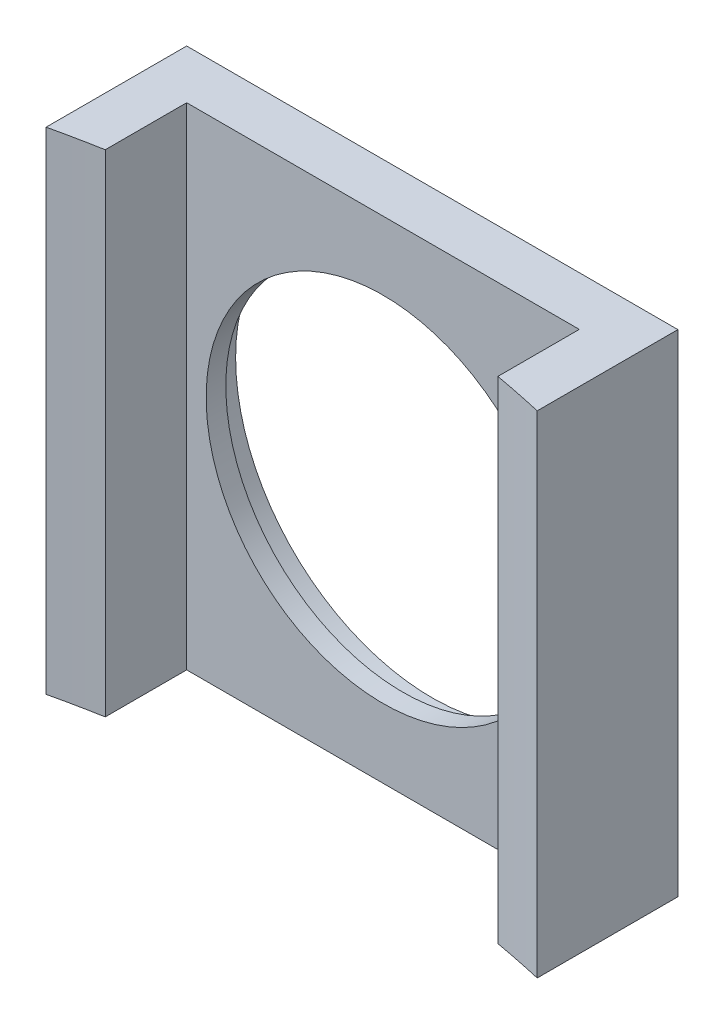
from build123d import *

# Parameters (mm, degrees)
SKETCH2_W               = 50
SKETCH2_H               = 50
BOSS_EXTRUDE1_DEPTH     = 5
SKETCH3_W               = 5
SKETCH3_H               = 50
SKETCH3_W_2             = 5.036023039
BOSS_EXTRUDE2_DEPTH     = 11
CUT_EXTRUDE3_DEPTH      = 51.174718111
CUT_EXTRUDE3_DEPTH_BACK = 51.174718111
SKETCH5_R               = 18
SKETCH6_R               = 20
CUT_EXTRUDE4_DEPTH      = 3
CUT_EXTRUDE5_DEPTH      = 51.174718111
CUT_EXTRUDE5_DEPTH_BACK = 51.174718111
SKETCH7_R               = 112.5


with BuildPart() as part:
    # Sketch2 → Boss-Extrude1 (new body)
    with BuildSketch(Plane.XY):
        with Locations((-12.301587302, 4.497354497)):
            Rectangle(SKETCH2_W, SKETCH2_H)
    extrude(amount=BOSS_EXTRUDE1_DEPTH)

    # Sketch3 → Boss-Extrude2 (add)
    with BuildSketch(Plane.XY.offset(5)):
        with Locations((-34.801587302, 4.497354497)):
            Rectangle(SKETCH3_W, SKETCH3_H)
        with Locations((10.180401179, 4.497354497)):
            Rectangle(SKETCH3_W_2, SKETCH3_H)
    extrude(amount=BOSS_EXTRUDE2_DEPTH)

    # Sketch5 → Cut-Extrude3 (cut, two sides: drawn at the far end of the back side and taken through both)
    with BuildSketch(Plane.XY.offset(-CUT_EXTRUDE3_DEPTH_BACK)):
        with Locations((-12.319598821, 4.529496056)):
            Circle(SKETCH5_R)
    extrude(amount=CUT_EXTRUDE3_DEPTH + CUT_EXTRUDE3_DEPTH_BACK, mode=Mode.SUBTRACT)

    # Sketch6 → Cut-Extrude4 (cut)
    with BuildSketch(Plane(origin=(0, 0, 0), x_dir=(-1, 0, 0), z_dir=(0, 0, -1))):
        with Locations((12.319598821, 4.529496056)):
            Circle(SKETCH6_R)
    extrude(amount=-CUT_EXTRUDE4_DEPTH, mode=Mode.SUBTRACT)

    # Sketch7 → Cut-Extrude5 (cut, two sides: drawn at the far end of the back side and taken through both)
    with BuildSketch(Plane(origin=(0, 0, 0), x_dir=(1, 0, 0), z_dir=(0, 1, 0)).offset(-CUT_EXTRUDE5_DEPTH_BACK)):
        with Locations((-12.319598821, -124)):
            Circle(SKETCH7_R)
    extrude(amount=CUT_EXTRUDE5_DEPTH + CUT_EXTRUDE5_DEPTH_BACK, mode=Mode.SUBTRACT)


solid = part.part
